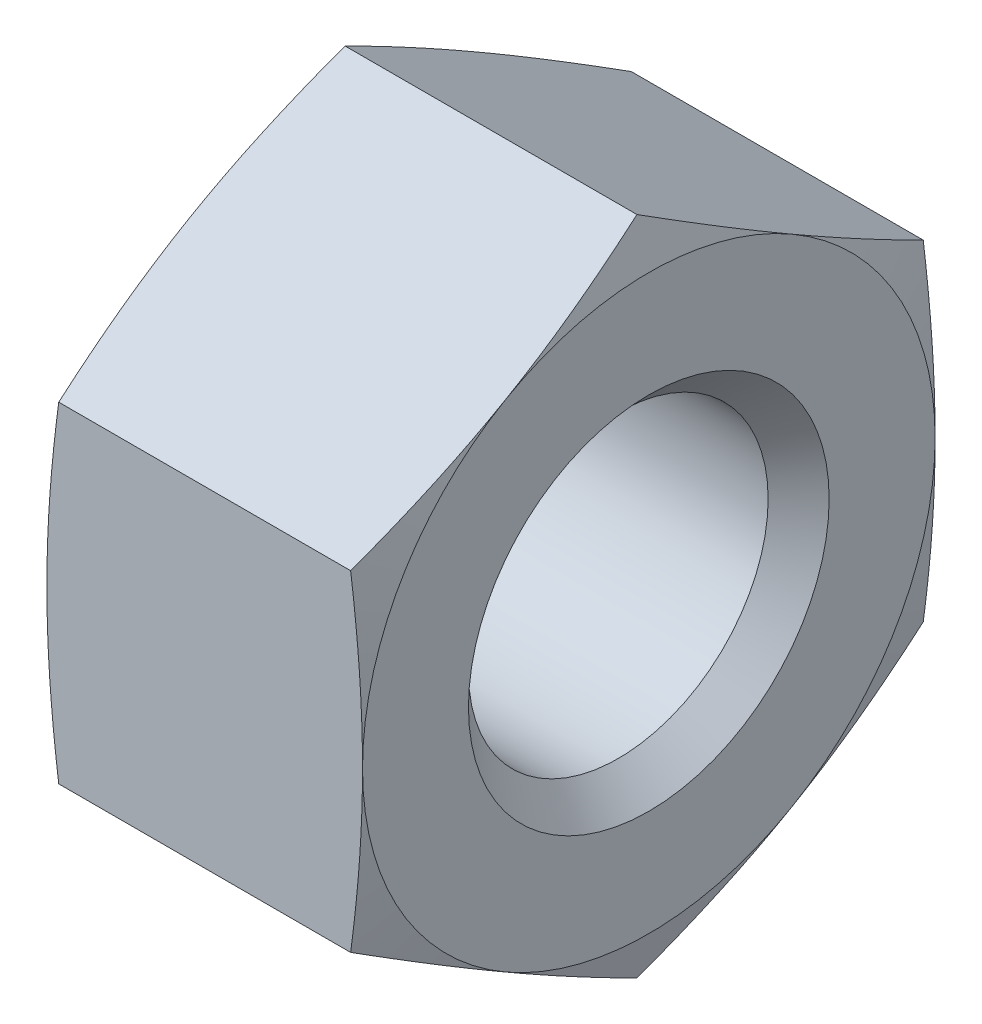
from build123d import *

# Parameters (mm, degrees)
CUT_EXTRUDE_1_DEPTH      = 3.5
CUT_EXTRUDE_1_DEPTH_BACK = 3.5
SKETCH_3_W               = 25.4
SKETCH_3_H               = 25.4


with BuildPart() as part:
    # 草图1 → 旋转1 (revolve)
    with BuildSketch(Plane.XY):
        Polygon((-3.5, 0), (-3.5, 6.35), (-2.844596275, 8.796), (2.844596275, 8.796), (3.5, 6.35), (3.5, 0), align=None)
    revolve(axis=Axis((3.5, 0, 0), (-1, 0, 0)))

    # 草图2 → 切除-旋转1 (revolve, cut)
    with BuildSketch(Plane.XY):
        Polygon((-3.5, 0), (-3.5, 4), (-2.8235, 3.3235), (2.8235, 3.3235), (3.5, 4), (3.5, 0), align=None)
    revolve(axis=Axis((3.5, 0, 0), (-1, 0, 0)), mode=Mode.SUBTRACT)

    # 草图3 → 切除-拉伸1 (cut, two sides: drawn at the far end of the back side and taken through both)
    with BuildSketch(Plane(origin=(0, 0, 0), x_dir=(0, 0, -1), z_dir=(1, 0, 0)).offset(-CUT_EXTRUDE_1_DEPTH_BACK)):
        Rectangle(SKETCH_3_W, SKETCH_3_H)
        Polygon((-6.35, 3.666174209), (-6.35, -3.666174209), (0, -7.332348419), (6.35, -3.666174209), (6.35, 3.666174209), (0, 7.332348419), align=None, mode=Mode.SUBTRACT)
    extrude(amount=CUT_EXTRUDE_1_DEPTH + CUT_EXTRUDE_1_DEPTH_BACK, mode=Mode.SUBTRACT)


solid = part.part
